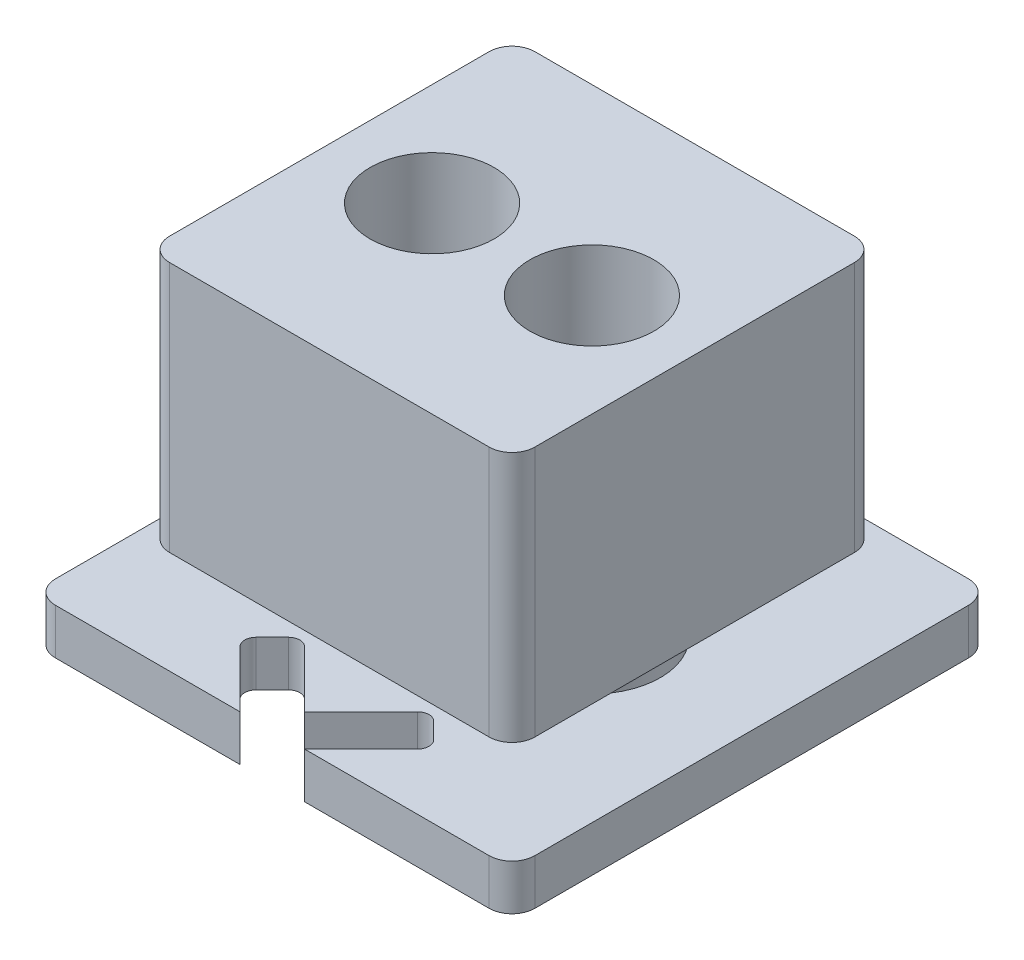
from build123d import *

# Parameters (mm, degrees)
SKETCH1_W           = 16
SKETCH1_H           = 16
BOSS_EXTRUDE1_DEPTH = 11
FILLET1_R           = 1
SKETCH4_R           = 3
BOSS_EXTRUDE2_DEPTH = 4
BOSS_EXTRUDE3_DEPTH = 2
SKETCH3_R           = 2.715
CUT_EXTRUDE2_DEPTH  = 22.106870919
CUT_EXTRUDE3_DEPTH  = 20.735754356


with BuildPart() as part:
    # Sketch1 → Boss-Extrude1 (new body)
    with BuildSketch(Plane(origin=(0, 0, 0), x_dir=(1, 0, 0), z_dir=(0, 1, 0))):
        Rectangle(SKETCH1_W, SKETCH1_H)
    extrude(amount=BOSS_EXTRUDE1_DEPTH)

    # Fillet1
    fillet1_edges = [part.edges().sort_by_distance(p)[0] for p in [
        (8, 5.5, 8),
        (-8, 5.5, 8),
        (-8, 5.5, -8),
        (8, 5.5, -8),
    ]]
    fillet(fillet1_edges, radius=FILLET1_R)

    # Sketch4 → Boss-Extrude2 (add)
    with BuildSketch(Plane(origin=(0, 0, 0), x_dir=(-1, 0, 0), z_dir=(0, -1, 0))):
        with Locations(Location((3.5, 0, 0), (0, 0, 90))):
            Circle(SKETCH4_R)
        with Locations(Location((-3.5, 0, 0), (0, 0, 90))):
            Circle(SKETCH4_R)
    extrude(amount=BOSS_EXTRUDE2_DEPTH)

    # Sketch5 → Boss-Extrude3 (add)
    with BuildSketch(Plane(origin=(0, -4, 0), x_dir=(-1, 0, 0), z_dir=(0, -1, 0))):
        with BuildLine():
            Line((9.5, 10.5), (-9.5, 10.5))
            ThreePointArc((-9.5, 10.5), (-10.207106781, 10.207106781), (-10.5, 9.5))
            Line((-10.5, 9.5), (-10.5, -9.5))
            ThreePointArc((-10.5, -9.5), (-10.207106781, -10.207106781), (-9.5, -10.5))
            Line((-9.5, -10.5), (9.5, -10.5))
            ThreePointArc((9.5, -10.5), (10.207106781, -10.207106781), (10.5, -9.5))
            Line((10.5, -9.5), (10.5, 9.5))
            ThreePointArc((10.5, 9.5), (10.207106781, 10.207106781), (9.5, 10.5))
        make_face()
    extrude(amount=-BOSS_EXTRUDE3_DEPTH)

    # Sketch3 → Cut-Extrude2 (cut, through all)
    with BuildSketch(Plane(origin=(0, 11, 0), x_dir=(1, 0, 0), z_dir=(0, 1, 0))):
        with Locations(Location((-3.5, 0, 0), (0, 0, 270))):
            Circle(SKETCH3_R)
        with Locations(Location((3.5, 0, 0), (0, 0, 270))):
            Circle(SKETCH3_R)
    extrude(amount=-CUT_EXTRUDE2_DEPTH, mode=Mode.SUBTRACT)

    # Sketch7 → Cut-Extrude3 (cut, through all)
    with BuildSketch(Plane(origin=(0, -2, 0), x_dir=(1, 0, 0), z_dir=(0, 1, 0))):
        with BuildLine():
            Line((0, -9.085786438), (1.414213562, -10.5))
            Line((1.414213562, -10.5), (3.889087297, -8.025126266))
            ThreePointArc((3.889087297, -8.025126266), (4.035533906, -7.671572875), (3.889087297, -7.318019485))
            Line((3.889087297, -7.318019485), (3.181980515, -6.610912703))
            ThreePointArc((3.181980515, -6.610912703), (2.828427125, -6.464466094), (2.474873734, -6.610912703))
            Line((2.474873734, -6.610912703), (0, -9.085786438))
        make_face()
        with BuildLine():
            Line((-3.889087297, -8.025126266), (-1.414213562, -10.5))
            Line((-1.414213562, -10.5), (0, -9.085786438))
            Line((0, -9.085786438), (-2.474873734, -6.610912703))
            ThreePointArc((-2.474873734, -6.610912703), (-2.828427125, -6.464466094), (-3.181980515, -6.610912703))
            Line((-3.181980515, -6.610912703), (-3.889087297, -7.318019485))
            ThreePointArc((-3.889087297, -7.318019485), (-4.035533906, -7.671572875), (-3.889087297, -8.025126266))
        make_face()
        Polygon((-1.414213562, -10.5), (1.414213562, -10.5), (0, -9.085786438), align=None)
    extrude(amount=-CUT_EXTRUDE3_DEPTH, mode=Mode.SUBTRACT)


solid = part.part
